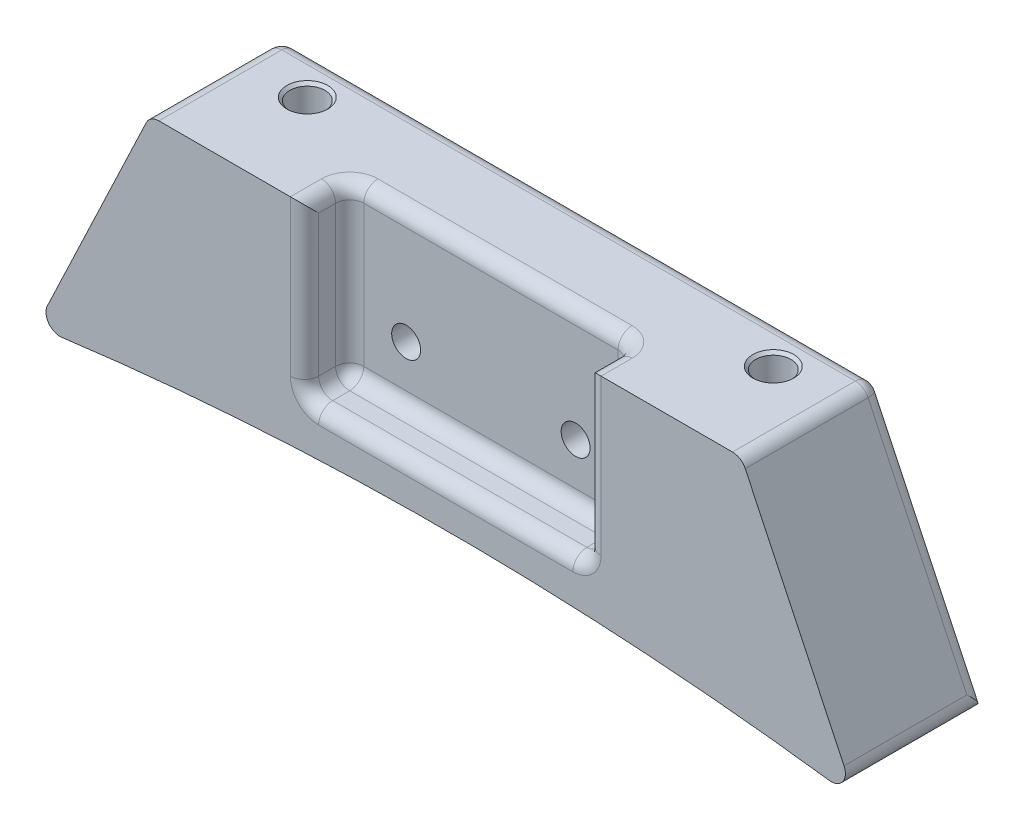
from build123d import *

# Parameters (mm, degrees)
SKETCH_1_R               = 0.5
EXTRUDE_1_DEPTH          = 9.7
HOLE_WIZARD_M3_1_D       = 2.5
HOLE_WIZARD_M3_1_DEPTH   = 7.5
HOLE_WIZARD_M3_1_TIP     = 0.751075774
CUT_EXTRUDE_2_DEPTH      = 35.037580378
CHAMFER_1_SIZE           = 0.5
CHAMFER_2_SIZE           = 0.2
SKETCH_11_W              = 20
SKETCH_11_H              = 12
CUT_EXTRUDE_3_DEPTH      = 3.2
FILLET_2_R               = 1
FILLET_3_R               = 1
HOLE_WIZARD_M2_5_3_D     = 2.05
HOLE_WIZARD_M2_5_3_DEPTH = 8.35
HOLE_WIZARD_M2_5_3_TIP   = 0.615882135


with BuildPart() as part:
    # 草图1 → 凸台-拉伸1 (new body)
    with BuildSketch(Plane.XY):
        with BuildLine():
            Line((-22, 14.94880858), (22, 14.94880858))
            Line((22, 14.94880858), (24.5, 14.94880858))
            Line((24.5, 14.94880858), (29, -2.012019578))
            ThreePointArc((29, -2.012019578), (0, 0), (-29, -2.012019578))
            Line((-29, -2.012019578), (-24.5, 14.94880858))
            Line((-24.5, 14.94880858), (-22, 14.94880858))
        make_face()
        with Locations((-6, 6.94880858)):
            Circle(SKETCH_1_R, mode=Mode.SUBTRACT)
        with Locations((6, 6.94880858)):
            Circle(SKETCH_1_R, mode=Mode.SUBTRACT)
    extrude(amount=EXTRUDE_1_DEPTH)

    # M3 螺纹孔1
    with Locations(Plane(origin=(0, 14.94880858, 0), x_dir=(-1, 0, 0), z_dir=(0, 1, 0))):
        with Locations((-16.5, 3), (16.5, 3)):
            Hole(HOLE_WIZARD_M3_1_D / 2, depth=HOLE_WIZARD_M3_1_DEPTH)
            with Locations((0, 0, -(HOLE_WIZARD_M3_1_DEPTH + HOLE_WIZARD_M3_1_TIP / 2))):  # 118° drill point
                Cone(0, HOLE_WIZARD_M3_1_D / 2, HOLE_WIZARD_M3_1_TIP, mode=Mode.SUBTRACT)

    # 草图10 → 切除-拉伸2 (cut, through all)
    with BuildSketch(Plane.XY.offset(9.7)):
        Polygon((29, -2.012019578), (20.914837438, 15.00313582), (24.5, 14.94880858), align=None)
    cut_extrude_2 = extrude(amount=-CUT_EXTRUDE_2_DEPTH, mode=Mode.SUBTRACT)

    # 镜向1: 切除-拉伸2 across plane
    add(cut_extrude_2.mirror(Plane(origin=(0, 0, 0), x_dir=(0, 0, 1), z_dir=(1, 0, 0))), mode=Mode.SUBTRACT)

    # 倒角1
    chamfer_1_edges = [part.edges().sort_by_distance(p)[0] for p in [
        (-6.5, 6.94880858, 0),
        (-6.5, 6.94880858, 9.7),
        (5.5, 6.94880858, 0),
        (5.5, 6.94880858, 9.7),
    ]]
    chamfer(chamfer_1_edges, length=CHAMFER_1_SIZE)

    # 倒角2
    chamfer_2_edges = [part.edges().sort_by_distance(p)[0] for p in [
        (-17.75, 14.94880858, 3),
        (15.25, 14.94880858, 3),
    ]]
    chamfer(chamfer_2_edges, length=CHAMFER_2_SIZE)

    # 草图11 → 切除-拉伸3 (cut)
    with BuildSketch(Plane.XY.offset(9.7)):
        with Locations((0, 8.94880858)):
            Rectangle(SKETCH_11_W, SKETCH_11_H)
    extrude(amount=-CUT_EXTRUDE_3_DEPTH, mode=Mode.SUBTRACT)

    # 圆角2
    fillet_2_edges = [part.edges().sort_by_distance(p)[0] for p in [
        (-10, 8.94880858, 6.5),
        (-10, 2.94880858, 8.1),
        (0, 14.94880858, 6.5),
        (-10, 14.94880858, 8.1),
        (10, 8.94880858, 6.5),
        (10, 14.94880858, 8.1),
        (0, 2.94880858, 6.5),
        (10, 2.94880858, 8.1),
        (-10, 8.94880858, 9.7),
        (0, 2.94880858, 9.7),
        (10, 8.94880858, 9.7),
    ]]
    fillet(fillet_2_edges, radius=FILLET_2_R)

    # 圆角3
    fillet_3_edges = [part.edges().sort_by_distance(p)[0] for p in [
        (29, -2.012019578, 4.85),
        (-29, -2.012019578, 4.85),
        (0, 14.94880858, 0),
        (20.94065234, 14.94880858, 4.85),
        (24.97032617, 6.468394501, 0),
        (-20.94065234, 14.94880858, 4.85),
        (-24.97032617, 6.468394501, 0),
    ]]
    fillet(fillet_3_edges, radius=FILLET_3_R)

    # M2.5 螺纹孔3
    with Locations(Plane(origin=(6, 6.94880858, 6.5), x_dir=(1, 0, 0), z_dir=(0, 0, 1))):
        with Locations((0, 0), (-12, 0)):
            Hole(HOLE_WIZARD_M2_5_3_D / 2, depth=HOLE_WIZARD_M2_5_3_DEPTH)
            with Locations((0, 0, -(HOLE_WIZARD_M2_5_3_DEPTH + HOLE_WIZARD_M2_5_3_TIP / 2))):  # 118° drill point
                Cone(0, HOLE_WIZARD_M2_5_3_D / 2, HOLE_WIZARD_M2_5_3_TIP, mode=Mode.SUBTRACT)


solid = part.part
